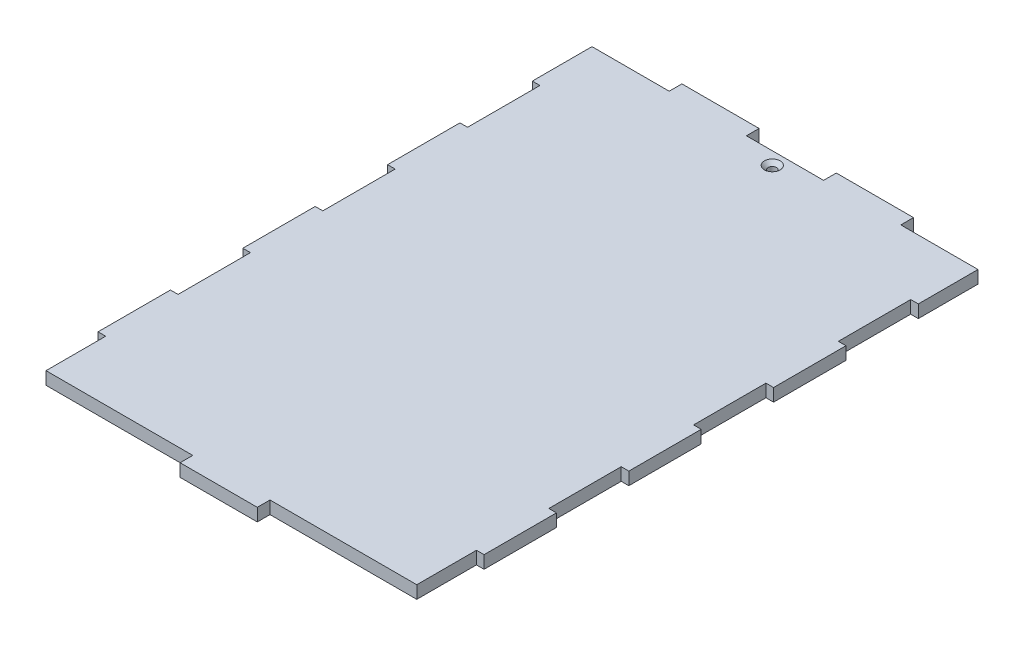
from build123d import *

# Parameters (mm, degrees)
BOSS_EXTRUDE1_DEPTH = 5
SKETCH2_R           = 1.6
CUT_EXTRUDE1_DEPTH  = 138.102151697
CHAMFER1_SIZE       = 1.5


with BuildPart() as part:
    # Sketch1 → Boss-Extrude1 (new body)
    with BuildSketch(Plane(origin=(0, 0, 0), x_dir=(1, 0, 0), z_dir=(0, 1, 0))):
        Polygon((0, -114), (-15.2, -114), (-15.2, -109), (-73, -109), (-73, -85.5), (-76, -85.5), (-76, -57), (-73, -57), (-73, -28.5), (-76, -28.5), (-76, 0), (-73, 0), (-73, 28.5), (-76, 28.5), (-76, 57), (-73, 57), (-73, 85.5), (-76, 85.5), (-76, 109), (-45.6, 109), (-45.6, 114), (-15.2, 114), (-15.2, 109), (0, 109), align=None)
    boss_extrude1 = extrude(amount=BOSS_EXTRUDE1_DEPTH)

    # Mirror1: Boss-Extrude1 across plane
    add(boss_extrude1.mirror(Plane(origin=(0, 5, 0), x_dir=(0, 0, 1), z_dir=(1, 0, 0))))

    # Sketch2 → Cut-Extrude1 (cut, through all)
    with BuildSketch(Plane(origin=(0, 5, 0), x_dir=(1, 0, 0), z_dir=(0, 1, 0))):
        with Locations(Location((0, 104, 0), (0, 0, 270))):
            Circle(SKETCH2_R)
    extrude(amount=-CUT_EXTRUDE1_DEPTH, mode=Mode.SUBTRACT)

    # Chamfer1
    chamfer1_edges = [part.edges().sort_by_distance(p)[0] for p in [
        (0, 5, -105.6),
    ]]
    chamfer(chamfer1_edges, length=CHAMFER1_SIZE)


solid = part.part
